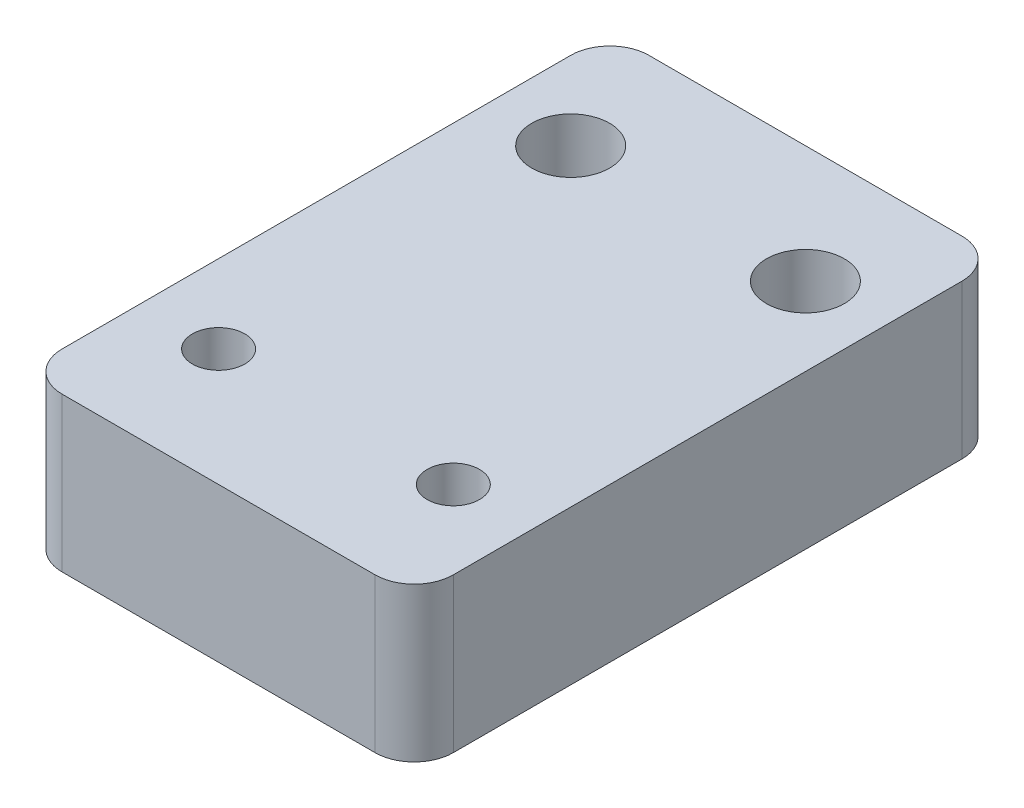
from build123d import *

# Parameters (mm, degrees)
SKETCH1_W           = 25.4
SKETCH1_H           = 38.1
SKETCH1_R           = 1.7
SKETCH1_R_2         = 2.5273
BOSS_EXTRUDE1_DEPTH = 10
FILLET1_R           = 2.54


with BuildPart() as part:
    # Sketch1 → Boss-Extrude1 (new body)
    with BuildSketch(Plane(origin=(0, 0, 0), x_dir=(1, 0, 0), z_dir=(0, 1, 0))):
        Rectangle(SKETCH1_W, SKETCH1_H)
        with Locations(Location((-7.62, -11.43, 0), (0, 0, 270))):
            Circle(SKETCH1_R, mode=Mode.SUBTRACT)
        with Locations(Location((7.62, -11.43, 0), (0, 0, 270))):
            Circle(SKETCH1_R, mode=Mode.SUBTRACT)
        with Locations(Location((-7.62, 11.43, 0), (0, 0, 270))):
            Circle(SKETCH1_R_2, mode=Mode.SUBTRACT)
        with Locations(Location((7.62, 11.43, 0), (0, 0, 270))):
            Circle(SKETCH1_R_2, mode=Mode.SUBTRACT)
    extrude(amount=BOSS_EXTRUDE1_DEPTH)

    # Fillet1
    fillet1_edges = [part.edges().sort_by_distance(p)[0] for p in [
        (12.7, 5, 19.05),
        (-12.7, 5, 19.05),
        (-12.7, 5, -19.05),
        (12.7, 5, -19.05),
    ]]
    fillet(fillet1_edges, radius=FILLET1_R)


solid = part.part
